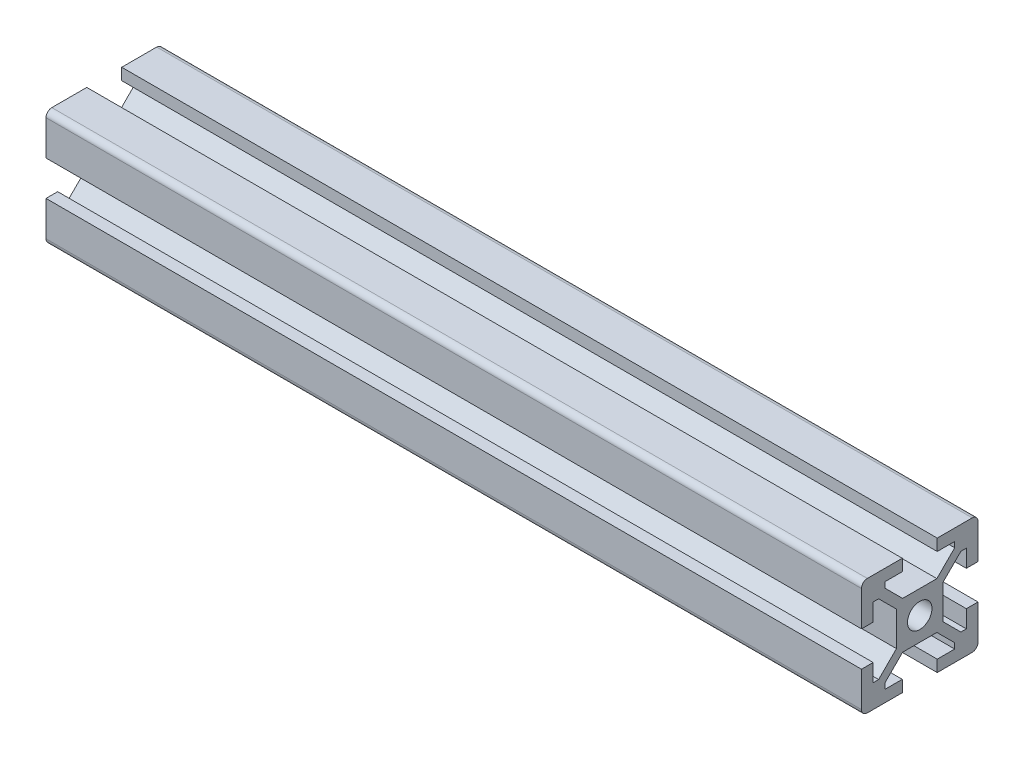
from build123d import *

# Parameters (mm, degrees)
SKETCH1_R           = 2.1
BOSS_EXTRUDE1_DEPTH = 140


with BuildPart() as part:
    # Sketch1 → Boss-Extrude1 (new body)
    with BuildSketch(Plane(origin=(0, 0, 0), x_dir=(0, 0, -1), z_dir=(1, 0, 0))):
        with BuildLine():
            Line((-10, 9), (-10, 3))
            Line((-10, 3), (-8, 3))
            Line((-8, 3), (-8, 6))
            Line((-8, 6), (-7.060660172, 6))
            Line((-7.060660172, 6), (-4, 2.939339828))
            Line((-4, 2.939339828), (-4, -2.939339828))
            Line((-4, -2.939339828), (-7.060660172, -6))
            Line((-7.060660172, -6), (-8, -6))
            Line((-8, -6), (-8, -3))
            Line((-8, -3), (-10, -3))
            Line((-10, -3), (-10, -9))
            ThreePointArc((-10, -9), (-9.707106781, -9.707106781), (-9, -10))
            Line((-9, -10), (-3, -10))
            Line((-3, -10), (-3, -8))
            Line((-3, -8), (-6, -8))
            Line((-6, -8), (-6, -7.060660172))
            Line((-6, -7.060660172), (-2.939339828, -4))
            Line((-2.939339828, -4), (2.939339828, -4))
            Line((2.939339828, -4), (6, -7.060660172))
            Line((6, -7.060660172), (6, -8))
            Line((6, -8), (3, -8))
            Line((3, -8), (3, -10))
            Line((3, -10), (9, -10))
            ThreePointArc((9, -10), (9.707106781, -9.707106781), (10, -9))
            Line((10, -9), (10, -3))
            Line((10, -3), (8, -3))
            Line((8, -3), (8, -6))
            Line((8, -6), (7.060660172, -6))
            Line((7.060660172, -6), (4, -2.939339828))
            Line((4, -2.939339828), (4, 2.939339828))
            Line((4, 2.939339828), (7.060660172, 6))
            Line((7.060660172, 6), (8, 6))
            Line((8, 6), (8, 3))
            Line((8, 3), (10, 3))
            Line((10, 3), (10, 9))
            ThreePointArc((10, 9), (9.707106781, 9.707106781), (9, 10))
            Line((9, 10), (3, 10))
            Line((3, 10), (3, 8))
            Line((3, 8), (6, 8))
            Line((6, 8), (6, 7.060660172))
            Line((6, 7.060660172), (2.939339828, 4))
            Line((2.939339828, 4), (-2.939339828, 4))
            Line((-2.939339828, 4), (-6, 7.060660172))
            Line((-6, 7.060660172), (-6, 8))
            Line((-6, 8), (-3, 8))
            Line((-3, 8), (-3, 10))
            Line((-3, 10), (-9, 10))
            ThreePointArc((-9, 10), (-9.707106781, 9.707106781), (-10, 9))
        make_face()
        Circle(SKETCH1_R, mode=Mode.SUBTRACT)
    extrude(amount=BOSS_EXTRUDE1_DEPTH)


solid = part.part
